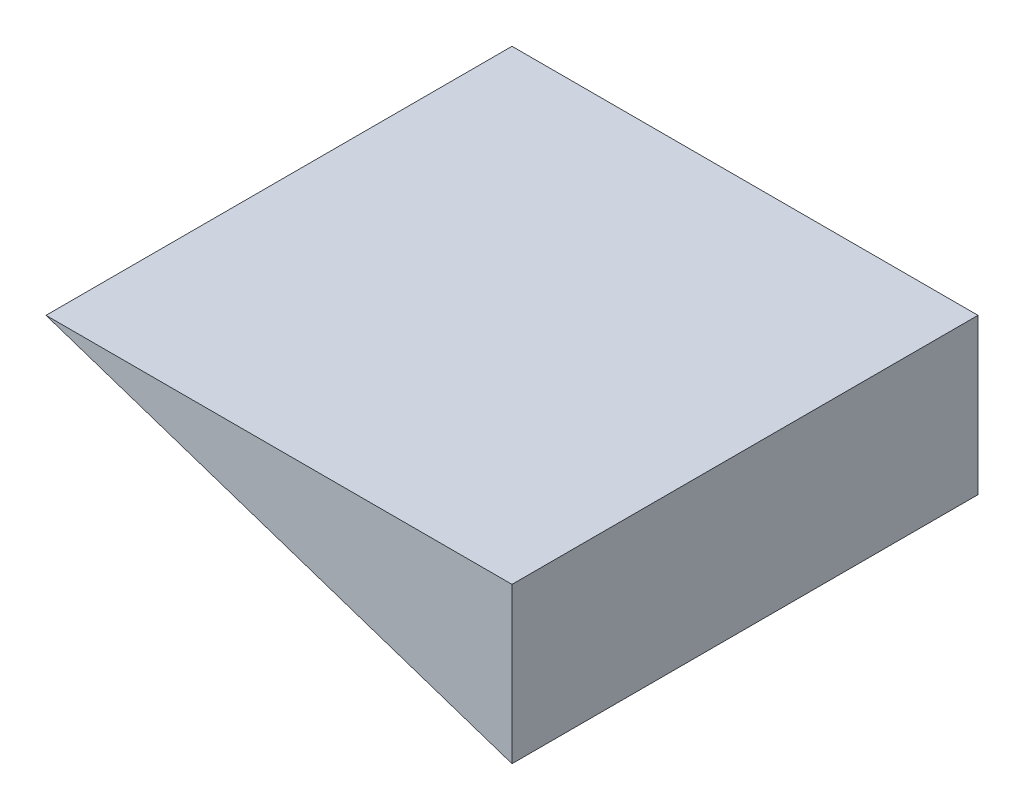
from build123d import *

# Parameters (mm, degrees)
SKETCH1_W           = 300
SKETCH1_H           = 100
BOSS_EXTRUDE1_DEPTH = 300
SKETCH3_W           = 288
SKETCH3_H           = 94
CUT_EXTRUDE2_DEPTH  = 294
CUT_EXTRUDE3_DEPTH  = 316
SCALE1_SCALE        = 0.001


with BuildPart() as part:
    # Sketch1 → Boss-Extrude1 (new body)
    with BuildSketch(Plane.XY):
        Rectangle(SKETCH1_W, SKETCH1_H)
    extrude(amount=-BOSS_EXTRUDE1_DEPTH)

    # Sketch3 → Cut-Extrude2 (cut)
    with BuildSketch(Plane.ZY.offset(150)):
        with Locations((-150, -3)):
            Rectangle(SKETCH3_W, SKETCH3_H)
    extrude(amount=-CUT_EXTRUDE2_DEPTH, mode=Mode.SUBTRACT)

    # Sketch2 → Cut-Extrude3 (cut)
    with BuildSketch(Plane.XY):
        Polygon((-150, 50), (-150, -50), (150, -50), align=None)
    extrude(amount=-CUT_EXTRUDE3_DEPTH, mode=Mode.SUBTRACT)


with BuildPart() as part_1:
    # Scale1: scaled about (41.330829635, 31.115283942, -150)
    add(part.part.scale(SCALE1_SCALE).moved(Location((41.289498805, 31.084168658, -149.85))))


solid = part_1.part
